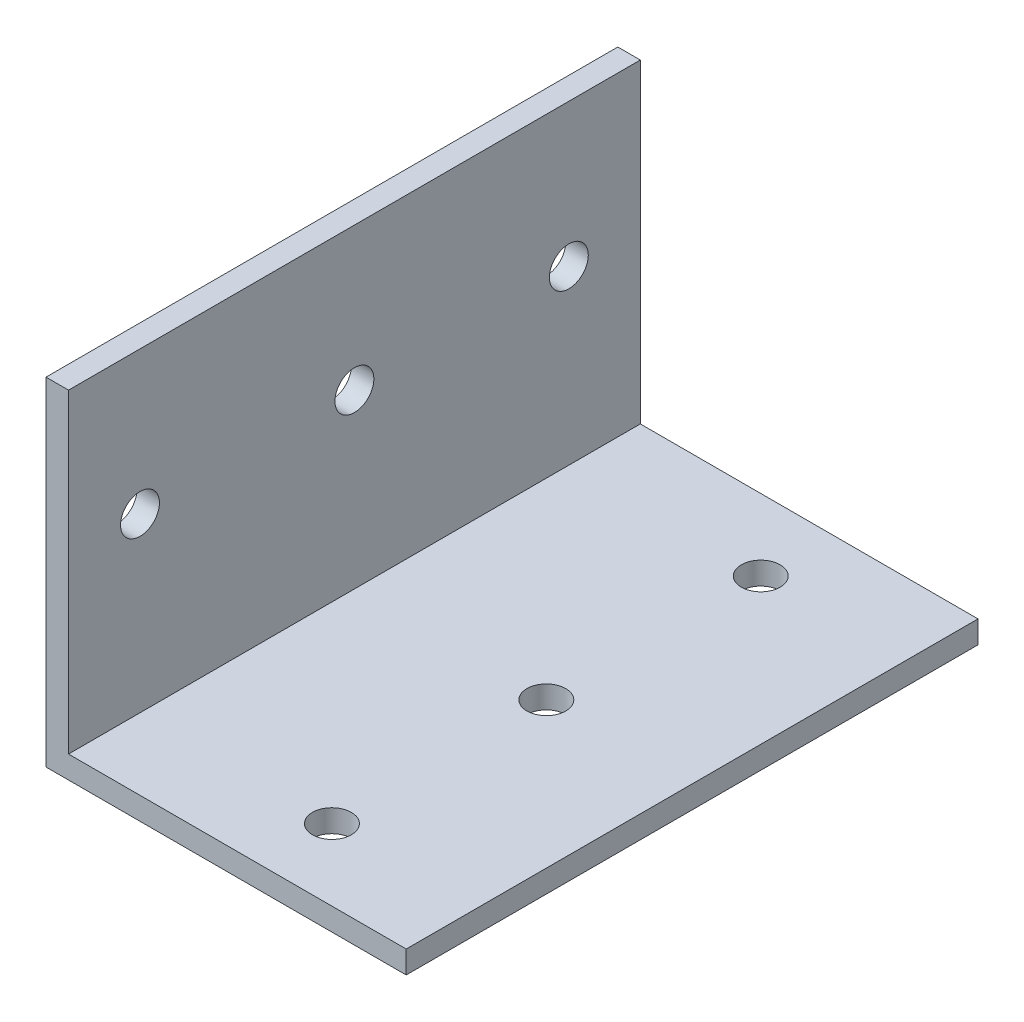
from build123d import *

# Parameters (mm, degrees)
BOSS_EXTRUDE1_DEPTH       = 50.8
TAP_DRILL_FOR_8_32_TAP1_D = 3.4544
TAP_DRILL_FOR_8_32_TAP2_D = 3.4544


with BuildPart() as part:
    # Sketch1 → Boss-Extrude1 (new body)
    with BuildSketch(Plane.XY):
        Polygon((0, 0), (0, -30), (32, -30), (32, -28), (2, -28), (2, 0), align=None)
    extrude(amount=BOSS_EXTRUDE1_DEPTH)

    # Tap Drill for #8-32 Tap1 (through all)
    with Locations(Plane(origin=(0, -28, 0), x_dir=(1, 0, 0), z_dir=(0, 1, 0))):
        with Locations((19.05, -6.35), (19.05, -44.45), (19.05, -25.4)):
            Hole(TAP_DRILL_FOR_8_32_TAP1_D / 2)

    # Tap Drill for #8-32 Tap2 (through all)
    with Locations(Plane(origin=(2, 0, 0), x_dir=(0, 0, -1), z_dir=(1, 0, 0))):
        with Locations((-44.45, -12.7), (-6.35, -12.7), (-25.4, -12.7)):
            Hole(TAP_DRILL_FOR_8_32_TAP2_D / 2)


solid = part.part
